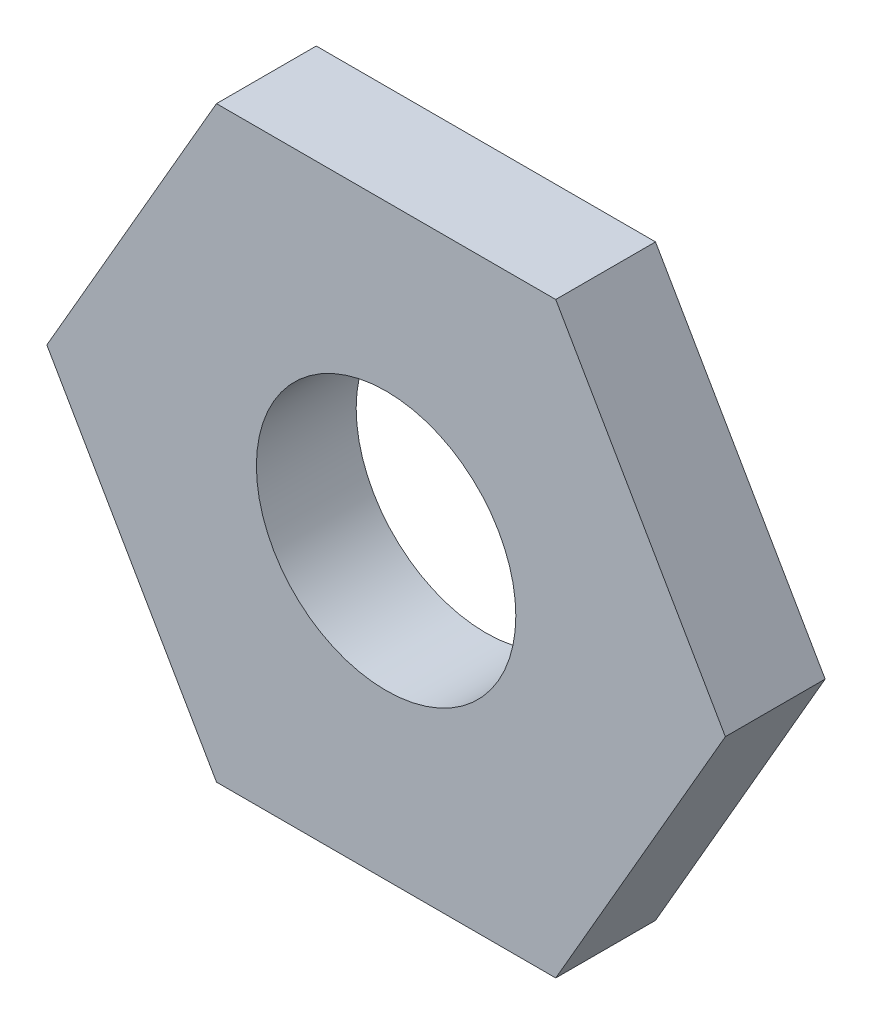
from build123d import *

# Parameters (mm, degrees)
BOSS_EXTRUDE1_DEPTH = 5
SKETCH2_R           = 6.5
CUT_EXTRUDE1_DEPTH  = 24.038012067


with BuildPart() as part:
    # Sketch1 → Boss-Extrude1 (new body)
    with BuildSketch(Plane.XY):
        Polygon((-8.5, 14.722431864), (-17, 0), (-8.5, -14.722431864), (8.5, -14.722431864), (17, 0), (8.5, 14.722431864), align=None)
    extrude(amount=BOSS_EXTRUDE1_DEPTH)

    # Sketch2 → Cut-Extrude1 (cut, through all)
    with BuildSketch(Plane.XY.offset(5)):
        Circle(SKETCH2_R)
    extrude(amount=-CUT_EXTRUDE1_DEPTH, mode=Mode.SUBTRACT)


solid = part.part
